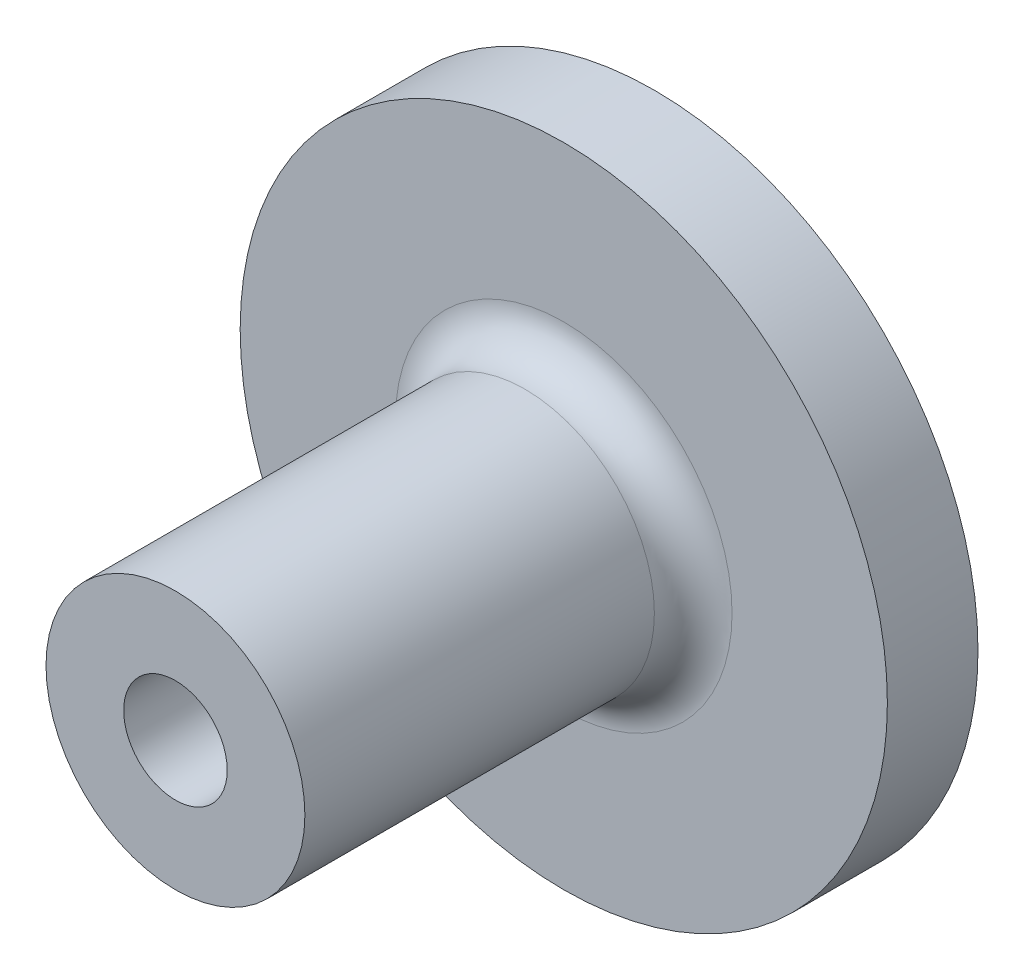
from build123d import *

# Parameters (mm, degrees)
SKETCH_1_R          = 25
EXTRUDE_1_DEPTH     = 7
SKETCH_2_R          = 10
EXTRUDE_2_DEPTH     = 30
FILLET_1_R          = 3
SKETCH_3_R          = 4
CUT_EXTRUDE_3_DEPTH = 52.176166328


with BuildPart() as part:
    # Эскиз1 → Вытянуть1 (new body)
    with BuildSketch(Plane.XY):
        Circle(SKETCH_1_R)
    extrude(amount=EXTRUDE_1_DEPTH)

    # Эскиз2 → Вытянуть2 (add)
    with BuildSketch(Plane.XY.offset(7)):
        Circle(SKETCH_2_R)
    extrude(amount=EXTRUDE_2_DEPTH)

    # Скругление1
    fillet_1_edges = [part.edges().sort_by_distance(p)[0] for p in [
        (-10, 0, 7),
    ]]
    fillet(fillet_1_edges, radius=FILLET_1_R)

    # Эскиз3 → Вытянуть3 (cut, through all)
    with BuildSketch(Plane.XY.offset(37)):
        Circle(SKETCH_3_R)
    extrude(amount=-CUT_EXTRUDE_3_DEPTH, mode=Mode.SUBTRACT)


solid = part.part
